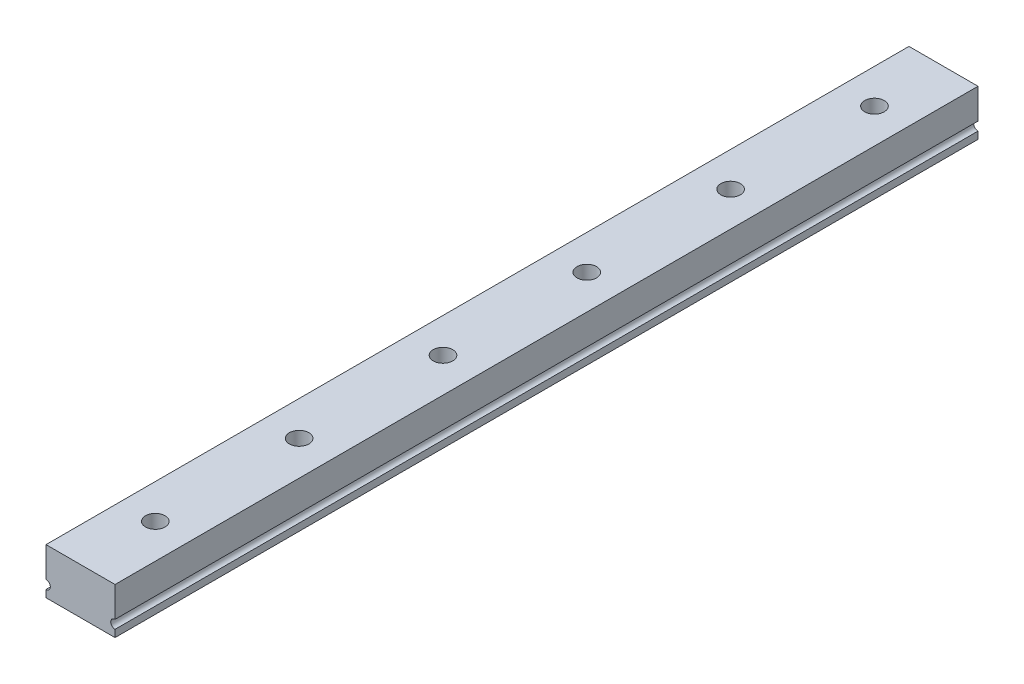
from build123d import *

# Parameters (mm, degrees)
BOSS_EXTRUDE1_START                          = -50
SKETCH1_W                                    = 12
SKETCH1_H                                    = 8
BOSS_EXTRUDE1_DEPTH                          = 150
CUT_EXTRUDE1_REACH                           = 154.709
SKETCH2_R                                    = 0.75
CBORE_FOR_M3_HEX_HEAD_CAP_SCREW1_D           = 3.4
CBORE_FOR_M3_HEX_HEAD_CAP_SCREW1_CBORE_D     = 9.351
CBORE_FOR_M3_HEX_HEAD_CAP_SCREW1_CBORE_DEPTH = 2
LPATTERN2_COUNT                              = 6
LPATTERN2_PITCH                              = 25


with BuildPart() as part:
    # Sketch1 → Boss-Extrude1 (new body)
    with BuildSketch(Plane.XY.offset(BOSS_EXTRUDE1_START)):
        with Locations((0, -24)):
            Rectangle(SKETCH1_W, SKETCH1_H)
    extrude(amount=-BOSS_EXTRUDE1_DEPTH)

    # Sketch2 → Cut-Extrude1 (cut, up to next)
    with BuildSketch(Plane.XY.offset(-50), mode=Mode.PRIVATE) as cut_extrude1_sk1:
        with Locations((-6, -26)):
            Circle(SKETCH2_R)
    cut_extrude1_tool1 = extrude(cut_extrude1_sk1.sketch, amount=-CUT_EXTRUDE1_REACH, mode=Mode.PRIVATE) & part.part
    # Sketch2 → Cut-Extrude1 (cut, up to next)
    with BuildSketch(Plane.XY.offset(-50), mode=Mode.PRIVATE) as cut_extrude1_sk2:
        with Locations((6, -26)):
            Circle(SKETCH2_R)
    cut_extrude1_tool2 = extrude(cut_extrude1_sk2.sketch, amount=-CUT_EXTRUDE1_REACH, mode=Mode.PRIVATE) & part.part
    add(cut_extrude1_tool1.solids().sort_by_distance((-6, -26, -50))[0], mode=Mode.SUBTRACT)
    add(cut_extrude1_tool2.solids().sort_by_distance((6, -26, -50))[0], mode=Mode.SUBTRACT)

    # CBORE for M3 Hex Head Cap Screw1 (through all)
    with Locations(Plane(origin=(0, -28, 0), x_dir=(-1, 0, 0), z_dir=(0, -1, 0))):
        with Locations((0, 63)):
            cbore_for_m3_hex_head_cap_screw1 = CounterBoreHole(CBORE_FOR_M3_HEX_HEAD_CAP_SCREW1_D / 2, CBORE_FOR_M3_HEX_HEAD_CAP_SCREW1_CBORE_D / 2, CBORE_FOR_M3_HEX_HEAD_CAP_SCREW1_CBORE_DEPTH)

    # LPattern2: CBORE for M3 Hex Head Cap Screw1 ×6
    with Locations(*[(0, 0, -i * LPATTERN2_PITCH) for i in range(1, LPATTERN2_COUNT)]):
        add(cbore_for_m3_hex_head_cap_screw1, mode=Mode.SUBTRACT)


solid = part.part
